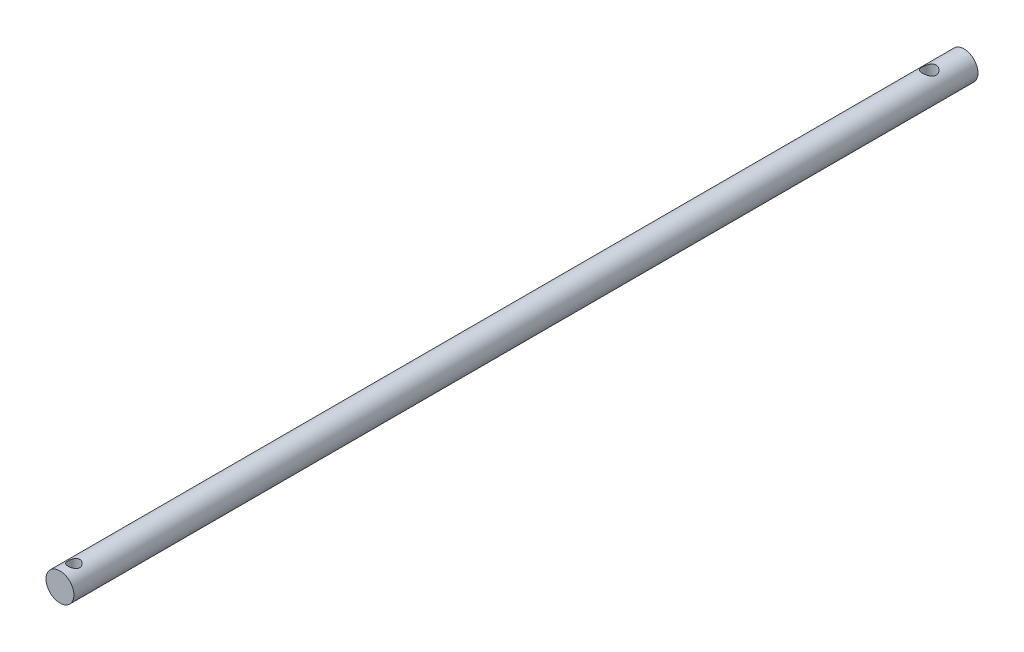
from build123d import *

# Parameters (mm, degrees)
SKETCH_1_R                   = 4
EXTRUDE_1_DEPTH              = 259
HOLE_WIZARD_M4_2_D           = 3.3
HOLE_WIZARD_M4_2_DEPTH       = 6.1
HOLE_WIZARD_M4_2_CBORE_D     = 4
HOLE_WIZARD_M4_2_CBORE_DEPTH = 4
HOLE_WIZARD_M4_2_TIP         = 0.991420021
SKETCH_7_R                   = 1.69
CUT_EXTRUDE_1_DEPTH          = 260.154394241


with BuildPart() as part:
    # 草图1 → 拉伸1 (new body)
    with BuildSketch(Plane.XY):
        Circle(SKETCH_1_R)
    extrude(amount=EXTRUDE_1_DEPTH)

    # M4 螺纹孔2
    with Locations(Plane(origin=(0, 4, 0), x_dir=(-1, 0, 0), z_dir=(0, 1, 0))):
        with Locations((0, 10)):
            CounterBoreHole(HOLE_WIZARD_M4_2_D / 2, HOLE_WIZARD_M4_2_CBORE_D / 2, HOLE_WIZARD_M4_2_CBORE_DEPTH, depth=HOLE_WIZARD_M4_2_DEPTH)
            with Locations((0, 0, -(HOLE_WIZARD_M4_2_DEPTH + HOLE_WIZARD_M4_2_TIP / 2))):  # 118° drill point
                Cone(0, HOLE_WIZARD_M4_2_D / 2, HOLE_WIZARD_M4_2_TIP, mode=Mode.SUBTRACT)

    # 草图7 → 切除-拉伸1 (cut, through all)
    with BuildSketch(Plane(origin=(0, 4, 0), x_dir=(-1, 0, 0), z_dir=(0, 1, 0))):
        with Locations(Location((0, 255, 0), (0, 0, 90))):
            Circle(SKETCH_7_R)
    extrude(amount=-CUT_EXTRUDE_1_DEPTH, mode=Mode.SUBTRACT)


solid = part.part
